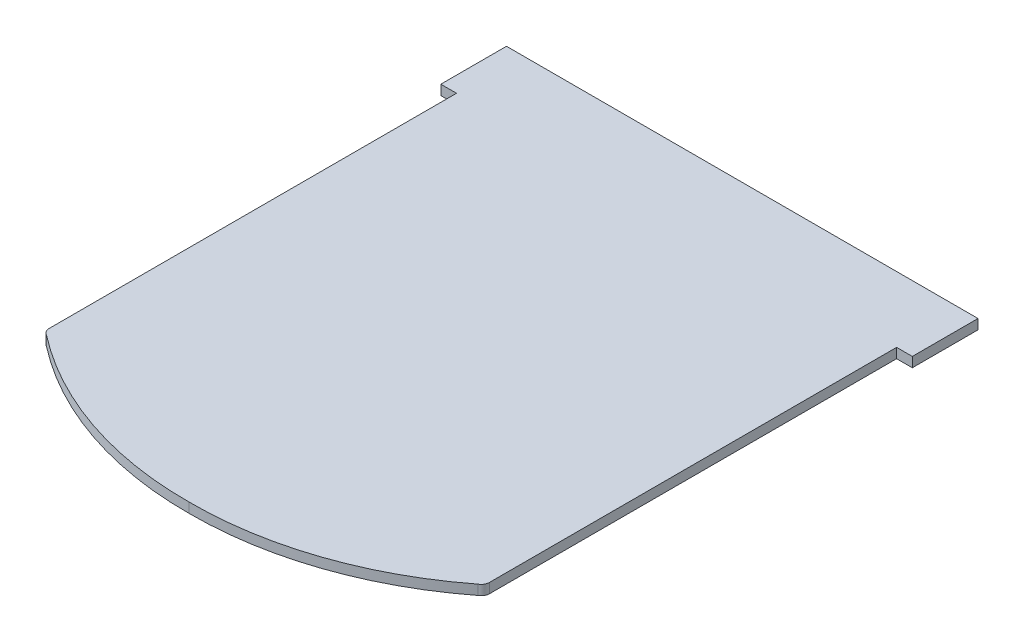
from build123d import *

# Parameters (mm, degrees)
BOSS_EXTRUDE3_DEPTH = 9.525


with BuildPart() as part:
    # Sketch1 → Boss-Extrude3 (new body)
    with BuildSketch(Plane(origin=(0, 0, 0), x_dir=(1, 0, 0), z_dir=(0, 1, 0))):
        with BuildLine():
            Line((-212.725, -228.6), (-212.725, 165.1))
            Line((-212.725, 165.1), (-227.9015, 165.1))
            Line((-227.9015, 165.1), (-227.9015, 228.6))
            Line((-227.9015, 228.6), (-212.725, 228.6))
            Line((-212.725, 228.6), (212.725, 228.6))
            Line((212.725, 228.6), (227.9015, 228.6))
            Line((227.9015, 228.6), (227.9015, 165.1))
            Line((227.9015, 165.1), (212.725, 165.1))
            Line((212.725, 165.1), (212.725, -228.6))
            ThreePointArc((212.725, -228.6), (211.576723559, -232.577910433), (208.573053823, -235.427520636))
            ThreePointArc((208.573053823, -235.427520636), (110.260259044, -288.46613371), (0, -306.3875))
            ThreePointArc((0, -306.3875), (-110.260259044, -288.46613371), (-208.573053823, -235.427520636))
            ThreePointArc((-208.573053823, -235.427520636), (-211.576723559, -232.577910433), (-212.725, -228.6))
        make_face()
    extrude(amount=BOSS_EXTRUDE3_DEPTH)


solid = part.part
